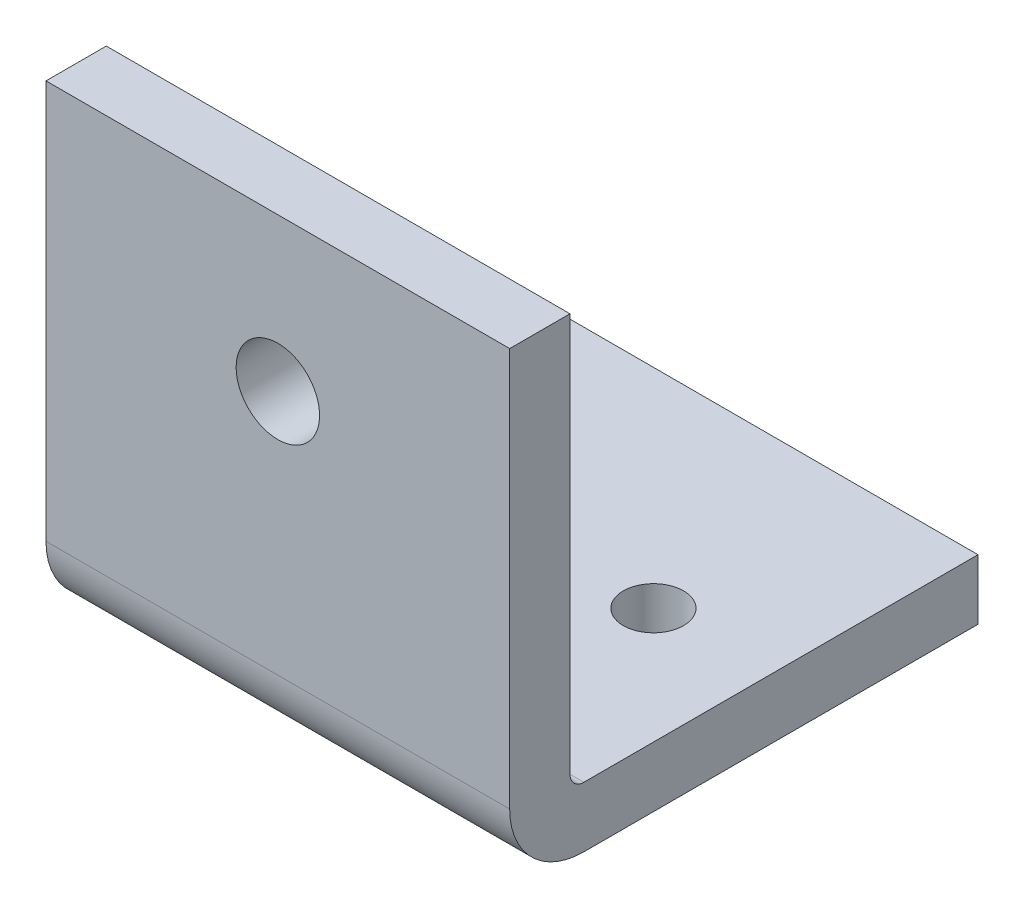
from build123d import *

# Parameters (mm, degrees)
ESTRUSIONE_SOTTILE1_DEPTH = 50
SCHIZZO4_R                = 6.5
TAGLIO_ESTRUSIONE1_DEPTH  = 144.603621124
SCHIZZO5_R                = 9
TAGLIO_ESTRUSIONE2_DEPTH  = 144.694119573
NERVATURA2_REACH          = 163.957
SCHIZZO6_WALL_W           = 354.197839966
SCHIZZO6_WALL_H           = 5


with BuildPart() as part:
    # Schizzo2 → Estrusione-Sottile1 (new, symmetric)
    with BuildSketch(Plane(origin=(0, 0, 0), x_dir=(0, 0, -1), z_dir=(1, 0, 0))):
        with BuildLine():
            Line((0, 102), (0, 16))
            ThreePointArc((0, 16), (4.686291501, 4.686291501), (16, 0))
            Line((16, 0), (101, 0))
            Line((101, 0), (101, 13))
            Line((101, 13), (16, 13))
            ThreePointArc((16, 13), (13.878679656, 13.878679656), (13, 16))
            Line((13, 16), (13, 102))
            Line((13, 102), (0, 102))
        make_face()
    extrude(amount=ESTRUSIONE_SOTTILE1_DEPTH, both=True)

    # Schizzo4 → Taglio-Estrusione1 (cut, through all)
    with BuildSketch(Plane(origin=(0, 13, 0), x_dir=(1, 0, 0), z_dir=(0, 1, 0))):
        with Locations(Location((-25, 56, 0), (0, 0, 270))):
            Circle(SCHIZZO4_R)
        with Locations(Location((25, 56, 0), (0, 0, 270))):
            Circle(SCHIZZO4_R)
    extrude(amount=-TAGLIO_ESTRUSIONE1_DEPTH, mode=Mode.SUBTRACT)

    # Schizzo5 → Taglio-Estrusione2 (cut, through all)
    with BuildSketch(Plane(origin=(0, 0, -13), x_dir=(-1, 0, 0), z_dir=(0, 0, -1))):
        with Locations((0, 69)):
            Circle(SCHIZZO5_R)
    extrude(amount=-TAGLIO_ESTRUSIONE2_DEPTH, mode=Mode.SUBTRACT)

    # Schizzo6 wall → Nervatura2 (add, up to next)
    with BuildSketch(Plane(origin=(25, 23, -23), x_dir=(0, -0.707106781187, -0.707106781187), z_dir=(0, 0.707106781187, -0.707106781187)), mode=Mode.PRIVATE) as nervatura2_sk1:
        Rectangle(SCHIZZO6_WALL_W, SCHIZZO6_WALL_H)
    nervatura2_tool1 = extrude(nervatura2_sk1.sketch, amount=-NERVATURA2_REACH, mode=Mode.PRIVATE) - part.part
    nervatura2 = nervatura2_tool1.solids().sort_by_distance((25, 23, -23))[0]
    add(nervatura2)

    # Specchia1: Nervatura2 across plane
    add(nervatura2.mirror(Plane(origin=(0, 0, 0), x_dir=(0, 0, 1), z_dir=(1, 0, 0))))


solid = part.part
